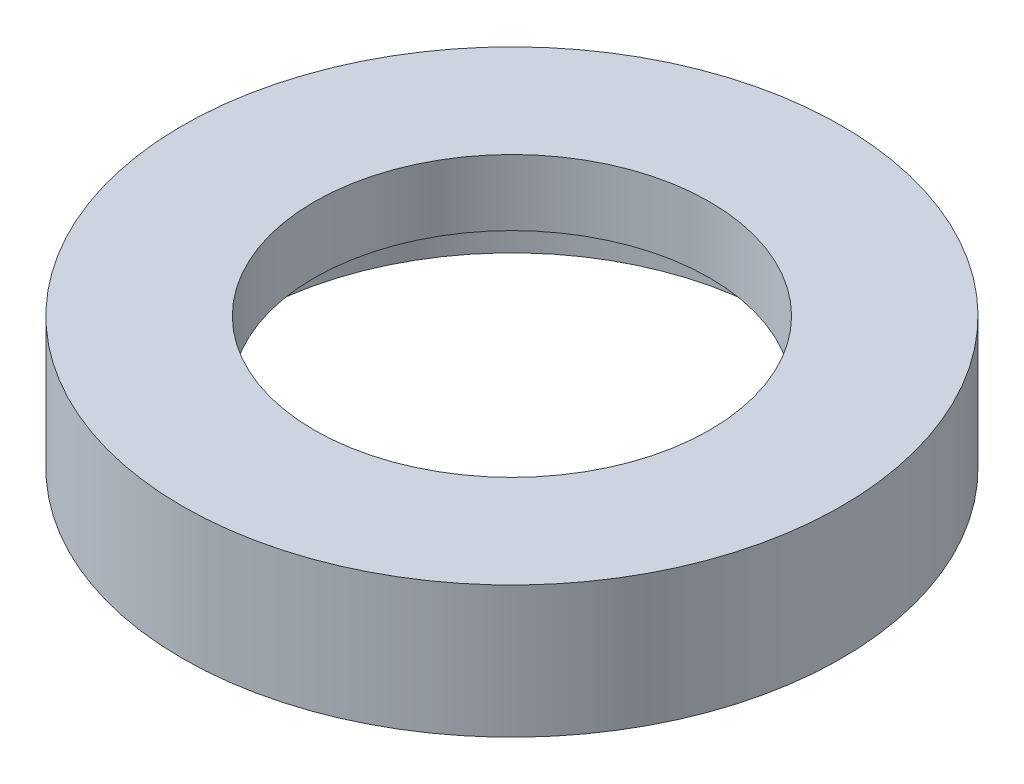
from build123d import *

# Parameters (mm, degrees)
SKETCH1_R           = 5
SKETCH1_R_2         = 4
BOSS_EXTRUDE1_DEPTH = 2
BOSS_EXTRUDE2_START = -1.9
SKETCH2_R           = 4
SKETCH2_R_2         = 3
BOSS_EXTRUDE2_DEPTH = 1.9
BOSS_EXTRUDE4_START = 0.1
SKETCH3_R           = 4
BOSS_EXTRUDE4_DEPTH = 0.1
SKETCH4_R           = 4
CUT_EXTRUDE1_DEPTH  = 1


with BuildPart() as part:
    # Sketch1 → Boss-Extrude1 (new body)
    with BuildSketch(Plane(origin=(0, 0, 0), x_dir=(1, 0, 0), z_dir=(0, 1, 0))):
        with Locations(Location((0, 0, 0), (0, 0, 270))):
            Circle(SKETCH1_R)
        with Locations(Location((0, 0, 0), (0, 0, 270))):
            Circle(SKETCH1_R_2, mode=Mode.SUBTRACT)
    extrude(amount=BOSS_EXTRUDE1_DEPTH)

    # Sketch2 → Boss-Extrude2 (add)
    with BuildSketch(Plane(origin=(0, 2, 0), x_dir=(1, 0, 0), z_dir=(0, 1, 0)).offset(BOSS_EXTRUDE2_START)):
        with Locations(Location((0, 0, 0), (0, 0, 270))):
            Circle(SKETCH2_R)
        with Locations(Location((0, 0, 0), (0, 0, 270))):
            Circle(SKETCH2_R_2, mode=Mode.SUBTRACT)
    extrude(amount=BOSS_EXTRUDE2_DEPTH)

    # Sketch3 → Boss-Extrude4 (add)
    with BuildSketch(Plane.XZ.offset(-0.1).offset(BOSS_EXTRUDE4_START)):
        Circle(SKETCH3_R)
    extrude(amount=-BOSS_EXTRUDE4_DEPTH)

    # Sketch4 → Cut-Extrude1 (cut)
    with BuildSketch(Plane.XZ):
        with Locations(Location((0, 0, 0), (0, 0, 270))):
            Circle(SKETCH4_R)
    extrude(amount=-CUT_EXTRUDE1_DEPTH, mode=Mode.SUBTRACT)


solid = part.part
